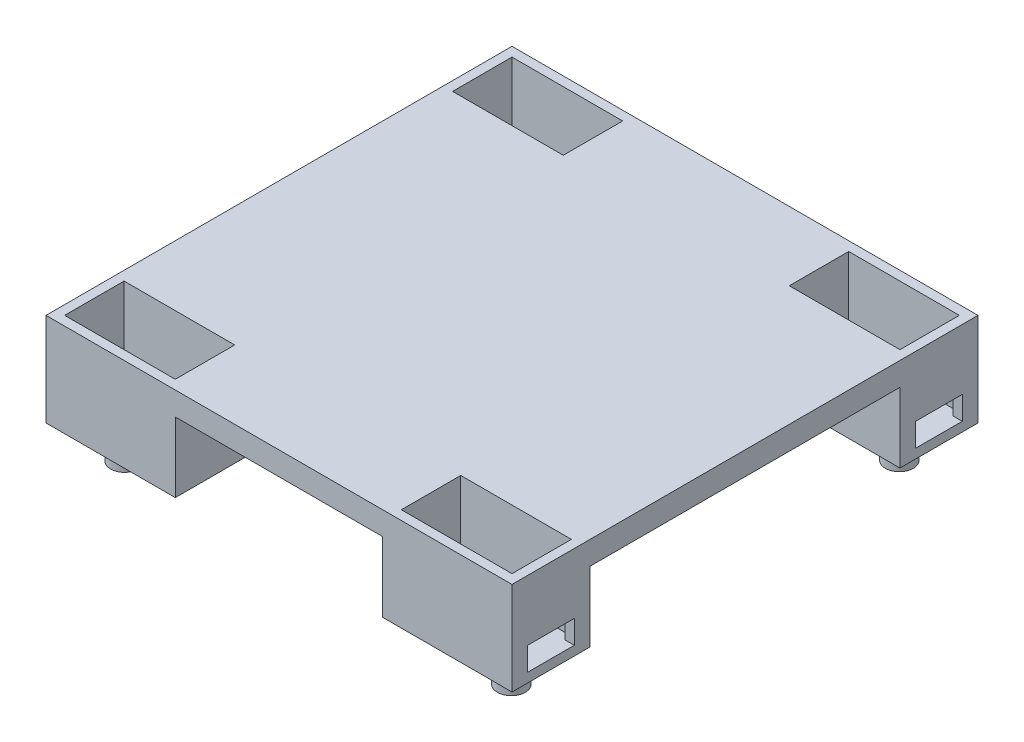
from build123d import *

# Parameters (mm, degrees)
BOSS_EXTRUDE1_DEPTH      = 2
BOSS_EXTRUDE1_DEPTH_BACK = 3
SKETCH1_W                = 100
SKETCH1_H                = 100
SKETCH3_W                = 27.75
SKETCH3_H                = 16.75
BOSS_EXTRUDE4_DEPTH      = 18
SKETCH4_W                = 23.75
SKETCH4_H                = 12.75
CUT_EXTRUDE1_DEPTH       = 18
SKETCH5_R                = 3
BOSS_EXTRUDE5_DEPTH      = 7
SKETCH6_W                = 10
SKETCH6_H                = 5
CUT_EXTRUDE2_DEPTH       = 2
SKETCH7_W                = 10
SKETCH7_H                = 5
CUT_EXTRUDE3_DEPTH       = 2


with BuildPart() as part:
    # Sketch1 → Boss-Extrude1 (new, two sides: drawn at the far end of the back side and taken through both)
    with BuildSketch(Plane(origin=(0, 0, 0), x_dir=(1, 0, 0), z_dir=(0, 1, 0)).offset(-BOSS_EXTRUDE1_DEPTH_BACK)):
        Rectangle(SKETCH1_W, SKETCH1_H)
    extrude(amount=BOSS_EXTRUDE1_DEPTH + BOSS_EXTRUDE1_DEPTH_BACK)

    # Sketch3 → Boss-Extrude4 (add)
    with BuildSketch(Plane(origin=(0, 0, 0), x_dir=(1, 0, 0), z_dir=(0, 1, 0))):
        with Locations((-36.125, -41.625)):
            Rectangle(SKETCH3_W, SKETCH3_H)
        with Locations((36.125, -41.625)):
            Rectangle(SKETCH3_W, SKETCH3_H)
        with Locations((36.125, 41.625)):
            Rectangle(SKETCH3_W, SKETCH3_H)
        with Locations((-36.125, 41.625)):
            Rectangle(SKETCH3_W, SKETCH3_H)
    extrude(amount=-BOSS_EXTRUDE4_DEPTH)

    # Sketch4 → Cut-Extrude1 (cut)
    with BuildSketch(Plane(origin=(0, 2, 0), x_dir=(1, 0, 0), z_dir=(0, 1, 0))):
        with Locations((-36.125, -41.625)):
            Rectangle(SKETCH4_W, SKETCH4_H)
        with Locations((36.125, -41.625)):
            Rectangle(SKETCH4_W, SKETCH4_H)
        with Locations((36.125, 41.625)):
            Rectangle(SKETCH4_W, SKETCH4_H)
        with Locations((-36.125, 41.625)):
            Rectangle(SKETCH4_W, SKETCH4_H)
    extrude(amount=-CUT_EXTRUDE1_DEPTH, mode=Mode.SUBTRACT)

    # Sketch5 → Boss-Extrude5 (add)
    with BuildSketch(Plane(origin=(0, -18, 0), x_dir=(-1, 0, 0), z_dir=(0, -1, 0))):
        with Locations(Location((41.5, -41.625, 0), (0, 0, 90))):
            Circle(SKETCH5_R)
        with Locations(Location((-41.5, -41.625, 0), (0, 0, 270))):
            Circle(SKETCH5_R)
        with Locations(Location((41.5, 41.625, 0), (0, 0, 270))):
            Circle(SKETCH5_R)
        with Locations(Location((-41.5, 41.625, 0), (0, 0, 270))):
            Circle(SKETCH5_R)
    extrude(amount=BOSS_EXTRUDE5_DEPTH)

    # Sketch6 → Cut-Extrude2 (cut)
    with BuildSketch(Plane(origin=(50, 0, 0), x_dir=(0, 0, -1), z_dir=(1, 0, 0))):
        with Locations((-41.625, -13.5)):
            Rectangle(SKETCH6_W, SKETCH6_H)
        with Locations((41.625, -13.5)):
            Rectangle(SKETCH6_W, SKETCH6_H)
    extrude(amount=-CUT_EXTRUDE2_DEPTH, mode=Mode.SUBTRACT)

    # Sketch7 → Cut-Extrude3 (cut)
    with BuildSketch(Plane.ZY.offset(50)):
        with Locations((41.625, -13.5)):
            Rectangle(SKETCH7_W, SKETCH7_H)
        with Locations((-41.625, -13.5)):
            Rectangle(SKETCH7_W, SKETCH7_H)
    extrude(amount=-CUT_EXTRUDE3_DEPTH, mode=Mode.SUBTRACT)


solid = part.part
